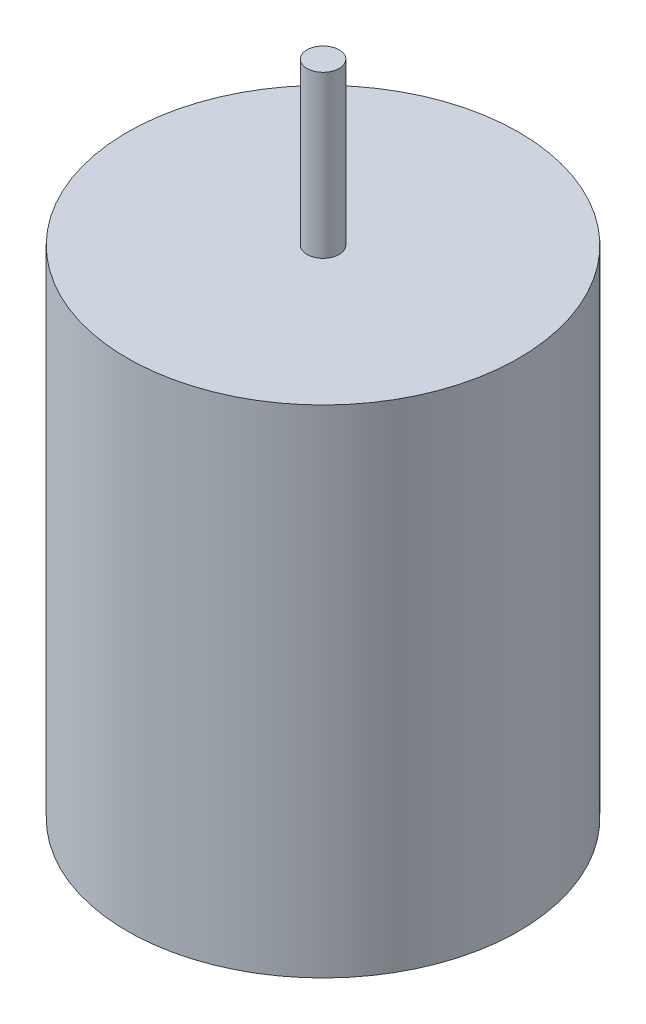
from build123d import *

# Parameters (mm, degrees)
SKETCH1_R           = 12.15
BOSS_EXTRUDE1_DEPTH = 30.8
SKETCH2_R           = 1
BOSS_EXTRUDE2_DEPTH = 10


with BuildPart() as part:
    # Sketch1 → Boss-Extrude1 (new body)
    with BuildSketch(Plane(origin=(0, 0, 0), x_dir=(1, 0, 0), z_dir=(0, 1, 0))):
        with Locations(Location((0, 0, 0), (0, 0, 90))):
            Circle(SKETCH1_R)
    extrude(amount=BOSS_EXTRUDE1_DEPTH)

    # Sketch2 → Boss-Extrude2 (add)
    with BuildSketch(Plane(origin=(0, 30.8, 0), x_dir=(1, 0, 0), z_dir=(0, 1, 0))):
        with Locations(Location((0, 0, 0), (0, 0, 270))):
            Circle(SKETCH2_R)
    extrude(amount=BOSS_EXTRUDE2_DEPTH)


solid = part.part
